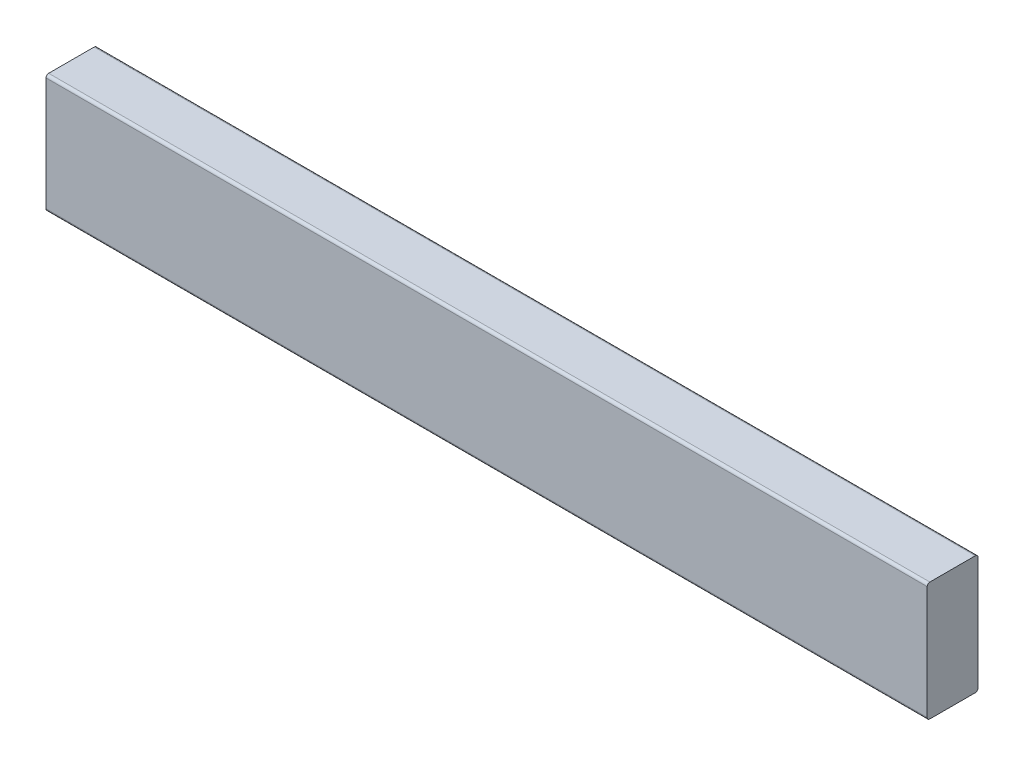
from build123d import *

# Parameters (mm, degrees)
SKETCH1_W           = 88.9
SKETCH1_H           = 38.1
BOSS_EXTRUDE1_DEPTH = 660.4
FILLET1_R           = 2


with BuildPart() as part:
    # Sketch1 → Boss-Extrude1 (new body)
    with BuildSketch(Plane(origin=(0, 0, 0), x_dir=(0, -1, 0), z_dir=(1, 0, 0))):
        Rectangle(SKETCH1_W, SKETCH1_H)
    extrude(amount=BOSS_EXTRUDE1_DEPTH)

    # Fillet1
    fillet1_edges = [part.edges().sort_by_distance(p)[0] for p in [
        (330.2, -44.45, 19.05),
        (330.2, 44.45, 19.05),
        (330.2, 44.45, -19.05),
        (330.2, -44.45, -19.05),
    ]]
    fillet(fillet1_edges, radius=FILLET1_R)


solid = part.part
